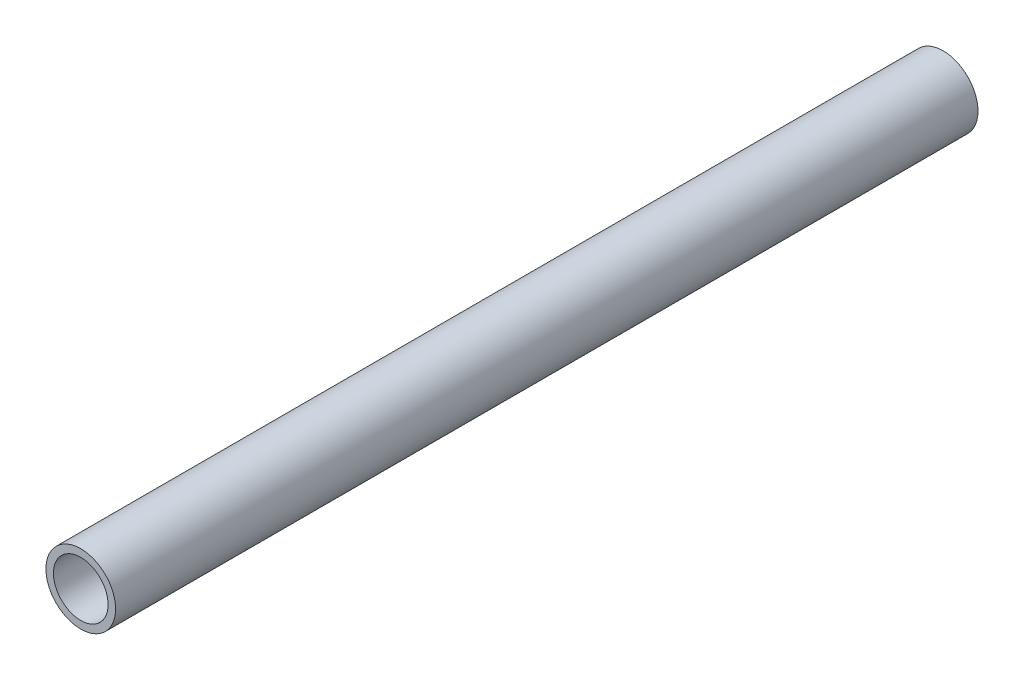
from build123d import *

# Parameters (mm, degrees)
SKETCH1_R           = 13.335
SKETCH1_R_2         = 10.4648
BOSS_EXTRUDE1_DEPTH = 330.2


with BuildPart() as part:
    # Sketch1 → Boss-Extrude1 (new body)
    with BuildSketch(Plane.XY):
        Circle(SKETCH1_R)
        Circle(SKETCH1_R_2, mode=Mode.SUBTRACT)
    extrude(amount=BOSS_EXTRUDE1_DEPTH)


solid = part.part
